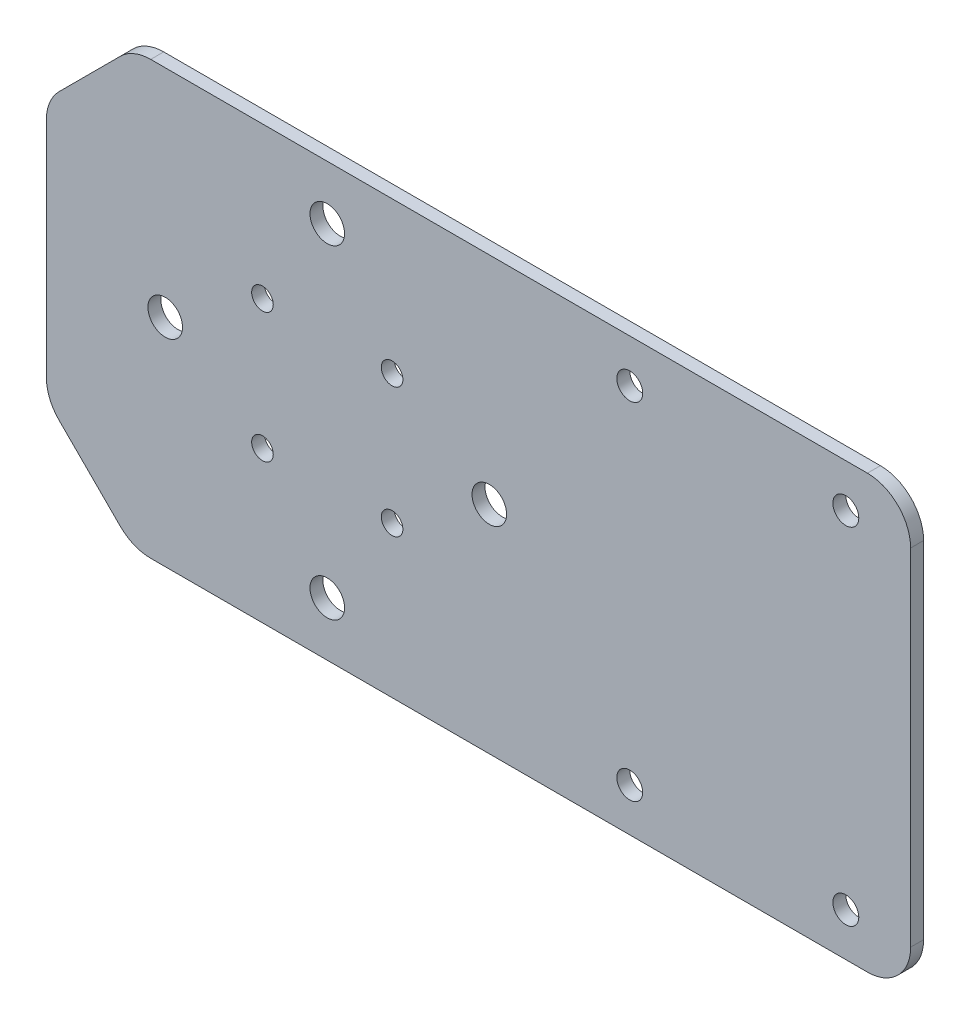
from build123d import *

# Parameters (mm, degrees)
SKETCH1_R                = 60
SKETCH1_R_2              = 4
BOSS_EXTRUDE1_DEPTH      = 3
SKETCH2_W                = 110
SKETCH2_H                = 12
BOSS_EXTRUDE2_DEPTH      = 4
F_5_0_5_DIAMETER_HOLE1_D = 5
SKETCH5_W                = 110
SKETCH5_H                = 100
SKETCH5_R                = 3
BOSS_EXTRUDE3_DEPTH      = 3
BOSS_EXTRUDE4_START      = -3
BOSS_EXTRUDE4_DEPTH      = 3
SKETCH7_W                = 250
SKETCH7_H                = 150
SKETCH7_W_2              = 200
SKETCH7_H_2              = 100
CUT_EXTRUDE1_DEPTH       = 5
CHAMFER1_SIZE            = 20
SKETCH8_R                = 4
CUT_EXTRUDE2_DEPTH       = 15
FILLET1_R                = 10
CUT_EXTRUDE3_START       = -4
SKETCH9_W                = 110
SKETCH9_H                = 12
SKETCH9_R                = 2.5
CUT_EXTRUDE3_DEPTH       = 4


with BuildPart() as part:
    # Sketch1 → Boss-Extrude1 (new body)
    with BuildSketch(Plane.XY):
        Circle(SKETCH1_R)
        with Locations((-37.5, 0)):
            Circle(SKETCH1_R_2, mode=Mode.SUBTRACT)
        with Locations((0, -37.5)):
            Circle(SKETCH1_R_2, mode=Mode.SUBTRACT)
        with Locations((37.5, 0)):
            Circle(SKETCH1_R_2, mode=Mode.SUBTRACT)
        with Locations((0, 37.5)):
            Circle(SKETCH1_R_2, mode=Mode.SUBTRACT)
    extrude(amount=BOSS_EXTRUDE1_DEPTH)

    # Sketch2 → Boss-Extrude2 (add)
    with BuildSketch(Plane.XY.offset(3)):
        with Locations((5, 15)):
            Rectangle(SKETCH2_W, SKETCH2_H)
    extrude(amount=BOSS_EXTRUDE2_DEPTH)

    # Ø5.0 (5) Diameter Hole1 (through all)
    with Locations(Plane.XY.offset(7)):
        with Locations((-15, 15), (15, 15), (-15, -15), (15, -15)):
            Hole(F_5_0_5_DIAMETER_HOLE1_D / 2)

    # Sketch5 → Boss-Extrude3 (add)
    with BuildSketch(Plane.XY.offset(3)):
        with Locations((80, 0)):
            Rectangle(SKETCH5_W, SKETCH5_H)
        with Locations((70, 39.998003983)):
            Circle(SKETCH5_R, mode=Mode.SUBTRACT)
        with Locations((119.99999996, 40)):
            Circle(SKETCH5_R, mode=Mode.SUBTRACT)
        with Locations((119.99999996, -40)):
            Circle(SKETCH5_R, mode=Mode.SUBTRACT)
        with Locations((70, -40.001996017)):
            Circle(SKETCH5_R, mode=Mode.SUBTRACT)
    extrude(amount=-BOSS_EXTRUDE3_DEPTH)

    # Sketch6 → Boss-Extrude4 (add)
    with BuildSketch(Plane.XY.offset(3).offset(BOSS_EXTRUDE4_START)):
        with BuildLine():
            ThreePointArc((-33.166247904, -50), (-60, 0), (-33.166247904, 50))
            Line((-33.166247904, 50), (-65, 50))
            Line((-65, 50), (-65, -50))
            Line((-65, -50), (-33.166247904, -50))
        make_face()
    extrude(amount=BOSS_EXTRUDE4_DEPTH)

    # Sketch7 → Cut-Extrude1 (cut)
    with BuildSketch(Plane.XY.offset(3)):
        with Locations((35, 0)):
            Rectangle(SKETCH7_W, SKETCH7_H)
        with Locations((35, 0)):
            Rectangle(SKETCH7_W_2, SKETCH7_H_2, mode=Mode.SUBTRACT)
    extrude(amount=-CUT_EXTRUDE1_DEPTH, mode=Mode.SUBTRACT)

    # Chamfer1
    chamfer1_edges = [part.edges().sort_by_distance(p)[0] for p in [
        (-65, 50, 1.5),
        (-65, -50, 1.5),
    ]]
    chamfer(chamfer1_edges, length=CHAMFER1_SIZE)

    # Sketch8 → Cut-Extrude2 (cut)
    with BuildSketch(Plane.XY.offset(3)):
        with Locations((37.5, 0)):
            Circle(SKETCH8_R)
    extrude(amount=-CUT_EXTRUDE2_DEPTH, mode=Mode.SUBTRACT)

    # Fillet1
    fillet1_edges = [part.edges().sort_by_distance(p)[0] for p in [
        (-45, 50, 1.5),
        (-65, -30, 1.5),
        (-65, 30, 1.5),
        (-45, -50, 1.5),
        (135, -50, 1.5),
        (135, 50, 1.5),
    ]]
    fillet(fillet1_edges, radius=FILLET1_R)

    # Sketch9 → Cut-Extrude3 (cut)
    with BuildSketch(Plane.XY.offset(7).offset(CUT_EXTRUDE3_START)):
        with Locations((5, 15)):
            Rectangle(SKETCH9_W, SKETCH9_H)
        with Locations((-15, 15)):
            Circle(SKETCH9_R, mode=Mode.SUBTRACT)
        with Locations((15, 15)):
            Circle(SKETCH9_R, mode=Mode.SUBTRACT)
    extrude(amount=CUT_EXTRUDE3_DEPTH, mode=Mode.SUBTRACT)


solid = part.part
